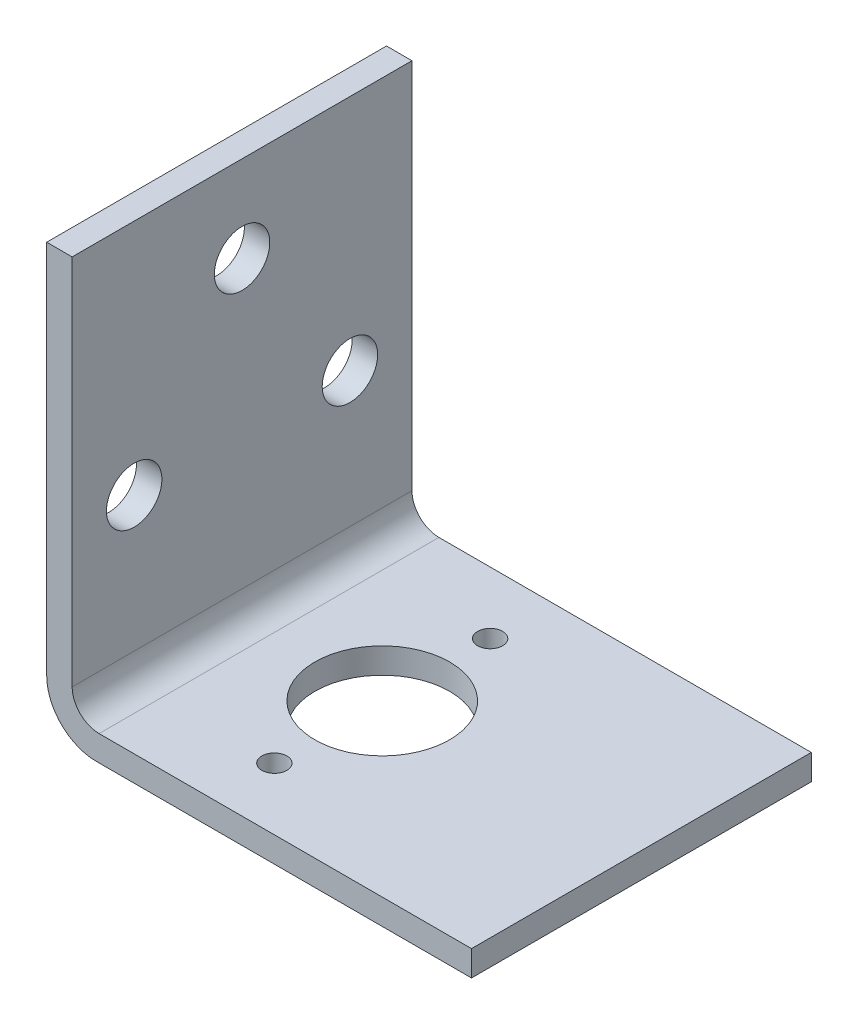
from build123d import *

# Parameters (mm, degrees)
BOSS_EXTRUDE1_DEPTH                = 40.005
F_4_40_FOR_NUT_VERTICAL_DEPTH      = 82.258355524
F_4_40_FOR_NUT_VERTICAL_DEPTH_BACK = 82.258355524
SKETCH3_R                          = 1.4732
SKETCH3_R_2                        = 7.9375
SKETCH4_R                          = 3.2639
F_1_4_20_MOUNTING_DEPTH            = 82.258355524


with BuildPart() as part:
    # Sketch2 → Boss-Extrude1 (new body)
    with BuildSketch(Plane.XY):
        with BuildLine():
            Line((0, 5.842), (0, 50.0126))
            Line((0, 50.0126), (2.9972, 50.0126))
            Line((2.9972, 50.0126), (2.9972, 6.1722))
            ThreePointArc((2.9972, 6.1722), (3.92713597, 3.92713597), (6.1722, 2.9972))
            Line((6.1722, 2.9972), (50.0126, 2.9972))
            Line((50.0126, 2.9972), (50.0126, 0))
            Line((50.0126, 0), (5.842, 0))
            ThreePointArc((5.842, 0), (1.711082184, 1.711082184), (0, 5.842))
        make_face()
    extrude(amount=BOSS_EXTRUDE1_DEPTH)

    # Sketch3 → 4-40 For Nut Vertical (cut, two sides: drawn at the far end of the back side and taken through both)
    with BuildSketch(Plane.XZ.offset(-F_4_40_FOR_NUT_VERTICAL_DEPTH_BACK)):
        with Locations(Location((19.500000116, 32.7025, 0), (0, 0, 270))):
            Circle(SKETCH3_R)
        with Locations(Location((19.500000116, 7.3025, 0), (0, 0, 270))):
            Circle(SKETCH3_R)
        with Locations(Location((19.500000116, 20.0025, 0), (0, 0, 270))):
            Circle(SKETCH3_R_2)
    extrude(amount=F_4_40_FOR_NUT_VERTICAL_DEPTH + F_4_40_FOR_NUT_VERTICAL_DEPTH_BACK, mode=Mode.SUBTRACT)

    # Sketch4 → 1/4-20 Mounting (cut, through all)
    with BuildSketch(Plane.ZY):
        with Locations((7.3025, 22.0726)):
            Circle(SKETCH4_R)
        with Locations((32.7025, 22.0726)):
            Circle(SKETCH4_R)
        with Locations((20.0025, 39.8526)):
            Circle(SKETCH4_R)
    extrude(amount=-F_1_4_20_MOUNTING_DEPTH, mode=Mode.SUBTRACT)


solid = part.part
